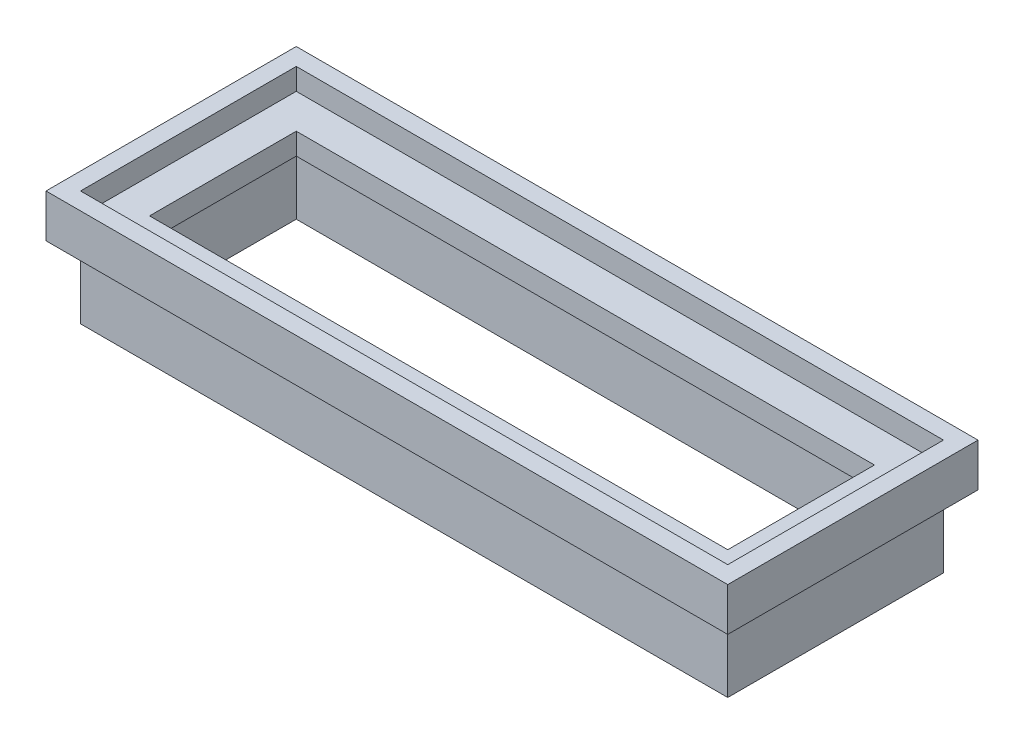
from build123d import *

# Parameters (mm, degrees)
SKETCH2_W           = 45
SKETCH2_H           = 15
SKETCH2_W_2         = 42.6
SKETCH2_H_2         = 12.6
EXTRUDE_THIN1_DEPTH = 5
SKETCH5_W           = 47.4
SKETCH5_H           = 17.4
SKETCH5_W_2         = 40.2
SKETCH5_H_2         = 10.2
EXTRUDE_THIN3_DEPTH = 3
SKETCH6_W           = 45
SKETCH6_H           = 15
CUT_EXTRUDE2_DEPTH  = 1.5


with BuildPart() as part:
    # Sketch2 → Extrude-Thin1 (new body)
    with BuildSketch(Plane(origin=(0, 0, 0), x_dir=(1, 0, 0), z_dir=(0, 1, 0))):
        with Locations((-5.576315789, 2.647368421)):
            Rectangle(SKETCH2_W, SKETCH2_H)
        with Locations((-5.576315789, 2.647368421)):
            Rectangle(SKETCH2_W_2, SKETCH2_H_2, mode=Mode.SUBTRACT)
    extrude(amount=EXTRUDE_THIN1_DEPTH)

    # Sketch5 → Extrude-Thin3 (add)
    with BuildSketch(Plane(origin=(0, 5, 0), x_dir=(1, 0, 0), z_dir=(0, 1, 0))):
        with Locations((-5.576315789, 2.647368421)):
            Rectangle(SKETCH5_W, SKETCH5_H)
        with Locations((-5.576315789, 2.647368421)):
            Rectangle(SKETCH5_W_2, SKETCH5_H_2, mode=Mode.SUBTRACT)
    extrude(amount=EXTRUDE_THIN3_DEPTH)

    # Sketch6 → Cut-Extrude2 (cut)
    with BuildSketch(Plane(origin=(0, 8, 0), x_dir=(1, 0, 0), z_dir=(0, 1, 0))):
        with Locations((-5.576315789, 2.647368421)):
            Rectangle(SKETCH6_W, SKETCH6_H)
    extrude(amount=-CUT_EXTRUDE2_DEPTH, mode=Mode.SUBTRACT)


solid = part.part
